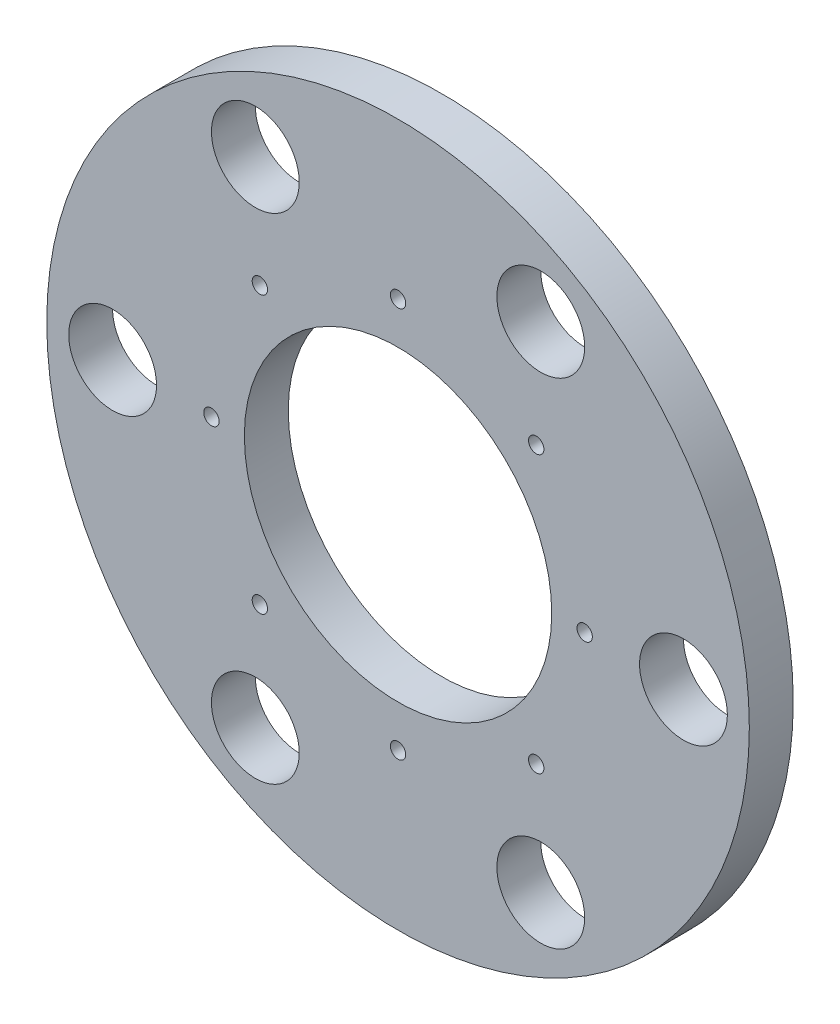
from build123d import *

# Parameters (mm, degrees)
SKETCH_3_R          = 80
EXTRUDE_1_DEPTH     = 10
SKETCH_4_R          = 35
CUT_EXTRUDE_1_DEPTH = 7
SKETCH_6_R          = 10
CUT_EXTRUDE_3_DEPTH = 10
SKETCH_5_R          = 1.75
CUT_EXTRUDE_4_DEPTH = 10
SKETCH_7_R          = 35
CUT_EXTRUDE_5_DEPTH = 20


with BuildPart() as part:
    # 草图3 → 凸台-拉伸1 (new body)
    with BuildSketch(Plane.XY):
        Circle(SKETCH_3_R)
    extrude(amount=-EXTRUDE_1_DEPTH)

    # 草图4 → 切除-拉伸1 (cut)
    with BuildSketch(Plane.XY):
        Circle(SKETCH_4_R)
    extrude(amount=-CUT_EXTRUDE_1_DEPTH, mode=Mode.SUBTRACT)

    # 草图6 → 切除-拉伸3 (cut)
    with BuildSketch(Plane.XY):
        with Locations((-32.5, 56.291651246)):
            Circle(SKETCH_6_R)
        with BuildLine():
            ThreePointArc((-75, 0), (-65, -10), (-55, 0))
            Line((-55, 0), (-75, 0))
        make_face()
        with BuildLine():
            Line((-75, 0), (-55, 0))
            ThreePointArc((-55, 0), (-65, 10), (-75, 0))
        make_face()
        with Locations((-32.5, -56.291651246)):
            Circle(SKETCH_6_R)
        with Locations((32.5, -56.291651246)):
            Circle(SKETCH_6_R)
        with Locations((65, 0)):
            Circle(SKETCH_6_R)
        with Locations((32.5, 56.291651246)):
            Circle(SKETCH_6_R)
    extrude(amount=-CUT_EXTRUDE_3_DEPTH, mode=Mode.SUBTRACT)

    # 草图5 → 切除-拉伸4 (cut)
    with BuildSketch(Plane.XY):
        with Locations((0, 44.5)):
            Circle(SKETCH_5_R)
        with Locations((31.466251763, 31.466251763)):
            Circle(SKETCH_5_R)
        with Locations((42.5, 0)):
            Circle(SKETCH_5_R)
        with Locations((31.466251763, -31.466251763)):
            Circle(SKETCH_5_R)
        with Locations((-31.466251763, -31.466251763)):
            Circle(SKETCH_5_R)
        with BuildLine():
            ThreePointArc((-44.25, 0), (-42.5, -1.75), (-40.75, 0))
            Line((-40.75, 0), (-44.25, 0))
        make_face()
        with BuildLine():
            Line((-44.25, 0), (-40.75, 0))
            ThreePointArc((-40.75, 0), (-42.5, 1.75), (-44.25, 0))
        make_face()
        with Locations((-31.466251763, 31.466251763)):
            Circle(SKETCH_5_R)
        with Locations((0, -44.5)):
            Circle(SKETCH_5_R)
    extrude(amount=-CUT_EXTRUDE_4_DEPTH, mode=Mode.SUBTRACT)

    # 草图7 → 切除-拉伸5 (cut, symmetric)
    with BuildSketch(Plane.XY):
        Circle(SKETCH_7_R)
    extrude(amount=CUT_EXTRUDE_5_DEPTH, both=True, mode=Mode.SUBTRACT)


solid = part.part
